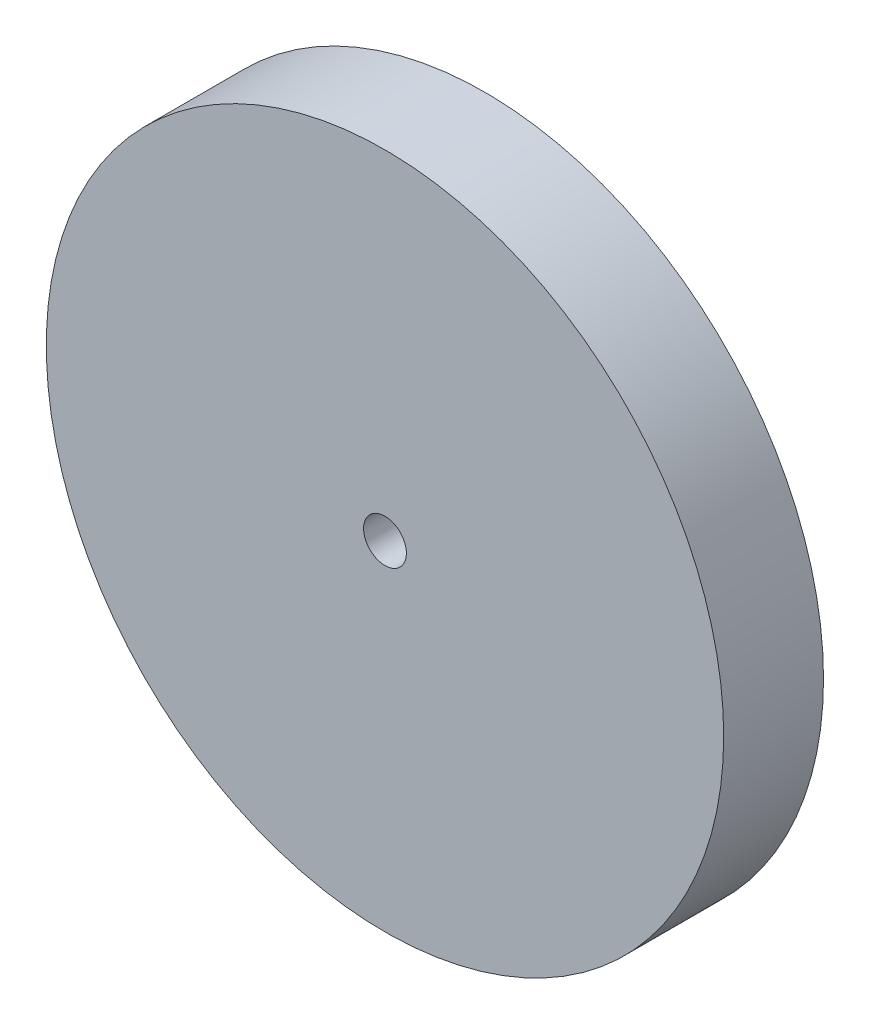
from build123d import *
from build123d.topology import SkipClean

# Parameters (mm, degrees)
SKETCH_1_R      = 47.5
SKETCH_1_R_2    = 3
EXTRUDE_1_DEPTH = 14
EXTRUDE_START   = 6
SKETCH_2_R      = 9
SKETCH_2_R_2    = 3
EXTRUDE_2_DEPTH = 6


with BuildPart() as part:
    # 草图1 → 凸台-拉伸1 (new body)
    with BuildSketch(Plane.XY):
        Circle(SKETCH_1_R)
        Circle(SKETCH_1_R_2, mode=Mode.SUBTRACT)
    extrude(amount=EXTRUDE_1_DEPTH)

    # 草图2 → 凸台-拉伸2 (add)
    with SkipClean():  # the faces are left unmerged after this step: merging them gives an invalid solid
        with BuildSketch(Plane(origin=(0, 0, 0), x_dir=(-1, 0, 0), z_dir=(0, 0, -1)).offset(EXTRUDE_START)):
            with Locations(Location((0, 0, 0), (0, 0, 180))):
                Circle(SKETCH_2_R)
            Circle(SKETCH_2_R_2, mode=Mode.SUBTRACT)
        extrude(amount=-EXTRUDE_2_DEPTH)


solid = part.part
